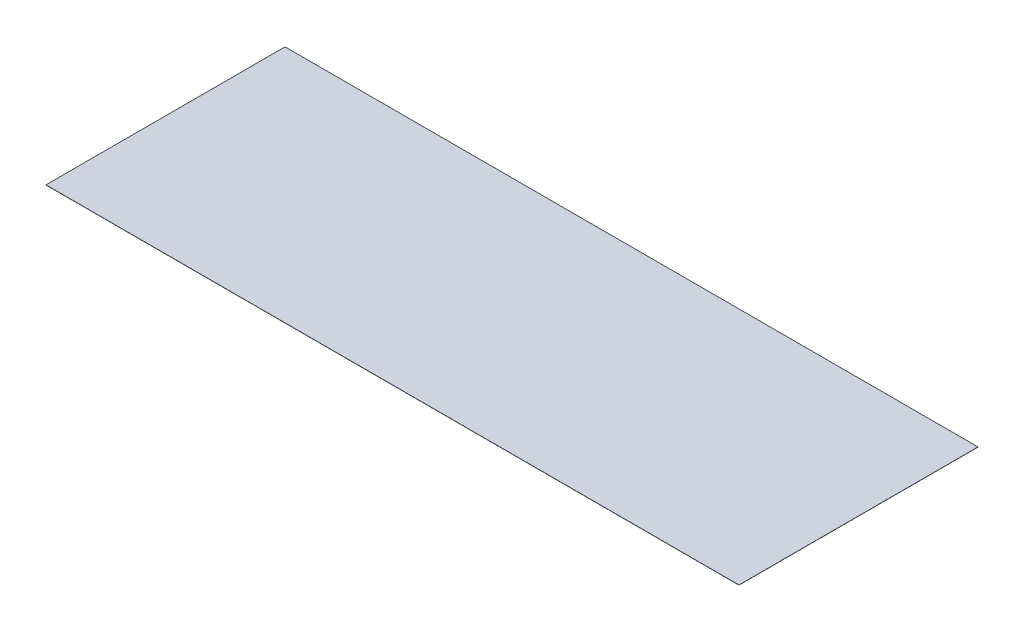
from build123d import *

# Parameters (mm, degrees)
SKETCH1_W           = 6096
SKETCH1_H           = 2102.612
BOSS_EXTRUDE1_DEPTH = 1.5875


with BuildPart() as part:
    # Sketch1 → Boss-Extrude1 (new body)
    with BuildSketch(Plane(origin=(0, 0, 0), x_dir=(1, 0, 0), z_dir=(0, 1, 0))):
        Rectangle(SKETCH1_W, SKETCH1_H)
    extrude(amount=BOSS_EXTRUDE1_DEPTH)


solid = part.part
